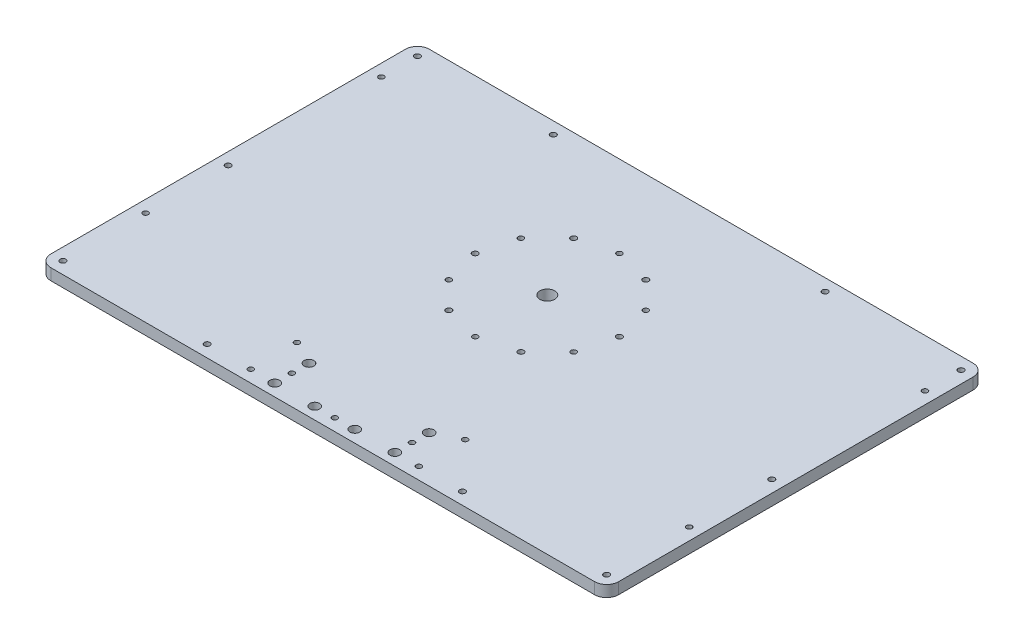
from build123d import *

# Parameters (mm, degrees)
SKETCH1_W           = 300
SKETCH1_H           = 200
BOSS_EXTRUDE1_DEPTH = 6
SKETCH6_R           = 4
CUT_EXTRUDE2_DEPTH  = 361.605047108
FILLET1_R           = 6.35
SKETCH2_R           = 1.5
CUT_EXTRUDE1_DEPTH  = 361.605047108
SKETCH13_R          = 1.6
M3_THROUGH2_DEPTH   = 364.853871767
SKETCH16_R          = 2.65
M5_THROUGH_DEPTH    = 358.420816406
SKETCH9_R           = 1.5
CUT_EXTRUDE3_DEPTH  = 361.605047108
SKETCH10_R          = 1.5
CUT_EXTRUDE5_DEPTH  = 361.605047108
SKETCH17_R          = 1.6
M3_THROUGH_DEPTH    = 361.605047108
MOVE_FACE2_BY       = 0.08
MOVE_FACE2_2_BY     = 0.08
MOVE_FACE2_3_BY     = 0.08
MOVE_FACE2_4_BY     = 0.08
MOVE_FACE2_5_BY     = 0.08
MOVE_FACE2_6_BY     = 0.08
MOVE_FACE2_7_BY     = 0.08
MOVE_FACE2_8_BY     = 0.08
MOVE_FACE2_9_BY     = 0.08
MOVE_FACE2_10_BY    = 0.08
MOVE_FACE2_11_BY    = 0.08
MOVE_FACE2_12_BY    = 0.08
MOVE_FACE2_13_BY    = 0.08
MOVE_FACE2_14_BY    = 0.08
MOVE_FACE2_15_BY    = 0.08
MOVE_FACE2_16_BY    = 0.08
MOVE_FACE2_17_BY    = 0.08
MOVE_FACE2_18_BY    = 0.08
MOVE_FACE2_19_BY    = 0.08
MOVE_FACE2_20_BY    = 0.08
MOVE_FACE2_21_BY    = 0.08
MOVE_FACE2_22_BY    = 0.08
MOVE_FACE2_23_BY    = 0.08
MOVE_FACE2_24_BY    = 0.08
MOVE_FACE2_25_BY    = 0.08
MOVE_FACE2_26_BY    = 0.08
MOVE_FACE2_27_BY    = 0.08
MOVE_FACE2_28_BY    = 0.08
MOVE_FACE2_29_BY    = 0.08
MOVE_FACE2_30_BY    = 0.08
MOVE_FACE2_31_BY    = 0.08
MOVE_FACE2_32_BY    = 0.08
MOVE_FACE2_33_BY    = 0.08
MOVE_FACE2_34_BY    = 0.08
MOVE_FACE2_35_BY    = 0.08
MOVE_FACE2_36_BY    = 0.08
MOVE_FACE2_37_BY    = 0.08
MOVE_FACE2_38_BY    = 0.08
MOVE_FACE2_39_BY    = 0.08
MOVE_FACE2_40_BY    = 0.08


with BuildPart() as part:
    # Sketch1 → Boss-Extrude1 (new body)
    with BuildSketch(Plane(origin=(0, 0, 0), x_dir=(1, 0, 0), z_dir=(0, 1, 0))):
        with Locations((150, 100)):
            Rectangle(SKETCH1_W, SKETCH1_H)
    extrude(amount=BOSS_EXTRUDE1_DEPTH)

    # Sketch6 → Cut-Extrude2 (cut, through all)
    with BuildSketch(Plane(origin=(0, 6, 0), x_dir=(1, 0, 0), z_dir=(0, 1, 0))):
        with Locations(Location((150, 118.65102, 0), (0, 0, 270))):
            Circle(SKETCH6_R)
    extrude(amount=-CUT_EXTRUDE2_DEPTH, mode=Mode.SUBTRACT)

    # Fillet1
    fillet1_edges = [part.edges().sort_by_distance(p)[0] for p in [
        (0, 3, -200),
        (300, 3, -200),
        (300, 3, 0),
        (0, 3, 0),
    ]]
    fillet(fillet1_edges, radius=FILLET1_R)

    # Sketch2 → Cut-Extrude1 (cut, through all)
    with BuildSketch(Plane(origin=(0, 6, 0), x_dir=(1, 0, 0), z_dir=(0, 1, 0))):
        with Locations(Location((6.35, 174.6, 0), (0, 0, 270))):
            Circle(SKETCH2_R)
        with Locations(Location((6.35, 49.9999, 0), (0, 0, 270))):
            Circle(SKETCH2_R)
        with Locations(Location((293.65, 49.9999, 0), (0, 0, 270))):
            Circle(SKETCH2_R)
        with Locations(Location((293.65, 174.6, 0), (0, 0, 270))):
            Circle(SKETCH2_R)
    extrude(amount=-CUT_EXTRUDE1_DEPTH, mode=Mode.SUBTRACT)

    # Sketch13 → M3-through2 (cut, through all)
    with BuildSketch(Plane(origin=(0, 6, 5.8), x_dir=(1, 0, 0), z_dir=(0, 1, 0))):
        with Locations(Location((6.35, 199.45, 0), (0, 0, 270))):
            Circle(SKETCH13_R)
        with Locations(Location((78.175, 199.45, 0), (0, 0, 270))):
            Circle(SKETCH13_R)
        with Locations(Location((221.825, 199.45, 0), (0, 0, 270))):
            Circle(SKETCH13_R)
        with Locations(Location((293.65, 199.45, 0), (0, 0, 270))):
            Circle(SKETCH13_R)
        with Locations(Location((293.65, 99.4498, 0), (0, 0, 270))):
            Circle(SKETCH13_R)
        with Locations(Location((293.65, 12.15, 0), (0, 0, 270))):
            Circle(SKETCH13_R)
        with Locations(Location((217.45, 12.15, 0), (0, 0, 270))):
            Circle(SKETCH13_R)
        with Locations(Location((82.55, 12.15, 0), (0, 0, 270))):
            Circle(SKETCH13_R)
        with Locations(Location((6.35, 12.15, 0), (0, 0, 270))):
            Circle(SKETCH13_R)
        with Locations(Location((6.35, 99.4498, 0), (0, 0, 270))):
            Circle(SKETCH13_R)
    extrude(amount=-M3_THROUGH2_DEPTH, mode=Mode.SUBTRACT)

    # Sketch16 → M5_through (cut, through all)
    with BuildSketch(Plane(origin=(0, 6, -5.8), x_dir=(1, 0, 0), z_dir=(0, -1, 0))):
        with Locations(Location((118.25, -18.65102, 0), (0, 0, 270))):
            Circle(SKETCH16_R)
        with Locations(Location((118.25, -0.55098, 0), (0, 0, 270))):
            Circle(SKETCH16_R)
        with Locations(Location((139.416666667, -0.55098, 0), (0, 0, 270))):
            Circle(SKETCH16_R)
        with Locations(Location((160.583333333, -0.55098, 0), (0, 0, 270))):
            Circle(SKETCH16_R)
        with Locations(Location((181.75, -0.55098, 0), (0, 0, 270))):
            Circle(SKETCH16_R)
        with Locations(Location((181.75, -18.65102, 0), (0, 0, 270))):
            Circle(SKETCH16_R)
    extrude(amount=M5_THROUGH_DEPTH, mode=Mode.SUBTRACT)

    # Sketch9 → Cut-Extrude3 (cut, through all)
    with BuildSketch(Plane(origin=(0, 6, 0), x_dir=(-1, 0, 0), z_dir=(0, 1, 0))):
        with Locations(Location((-118.25, -15.401, 0), (0, 0, 90))):
            Circle(SKETCH9_R)
        with Locations(Location((-150, -6.35098, 0), (0, 0, 90))):
            Circle(SKETCH9_R)
        with Locations(Location((-181.75, -15.401, 0), (0, 0, 90))):
            Circle(SKETCH9_R)
    extrude(amount=-CUT_EXTRUDE3_DEPTH, mode=Mode.SUBTRACT)

    # Sketch10 → Cut-Extrude5 (cut, through all)
    with BuildSketch(Plane(origin=(0, 6, 0), x_dir=(1, 0, 0), z_dir=(0, 1, 0))):
        with Locations(Location((150, 156.75102, 0), (0, 0, 270))):
            Circle(SKETCH10_R)
        with Locations(Location((182.995567884, 137.70102, 0), (0, 0, 270))):
            Circle(SKETCH10_R)
        with Locations(Location((182.995567884, 99.60102, 0), (0, 0, 270))):
            Circle(SKETCH10_R)
        with Locations(Location((150, 80.55102, 0), (0, 0, 270))):
            Circle(SKETCH10_R)
        with Locations(Location((117.004432116, 99.60102, 0), (0, 0, 270))):
            Circle(SKETCH10_R)
        with Locations(Location((117.004432116, 137.70102, 0), (0, 0, 270))):
            Circle(SKETCH10_R)
        with Locations(Location((105.55, 30.80102, 0), (0, 0, 270))):
            Circle(SKETCH10_R)
        with Locations(Location((105.55, 6.35, 0), (0, 0, 270))):
            Circle(SKETCH10_R)
        with Locations(Location((194.45, 6.35, 0), (0, 0, 90))):
            Circle(SKETCH10_R)
        with Locations(Location((194.45, 30.80102, 0), (0, 0, 90))):
            Circle(SKETCH10_R)
    extrude(amount=-CUT_EXTRUDE5_DEPTH, mode=Mode.SUBTRACT)

    # Sketch17 → M3-through (cut, through all)
    with BuildSketch(Plane(origin=(0, 6, 0), x_dir=(1, 0, 0), z_dir=(0, 1, 0))):
        with Locations(Location((188.1, 118.65102, 0), (0, 0, 270))):
            Circle(SKETCH17_R)
        with Locations(Location((169.05, 85.655452116, 0), (0, 0, 270))):
            Circle(SKETCH17_R)
        with Locations(Location((130.95, 85.655452116, 0), (0, 0, 270))):
            Circle(SKETCH17_R)
        with Locations(Location((111.9, 118.65102, 0), (0, 0, 270))):
            Circle(SKETCH17_R)
        with Locations(Location((130.95, 151.646587884, 0), (0, 0, 270))):
            Circle(SKETCH17_R)
        with Locations(Location((169.05, 151.646587884, 0), (0, 0, 270))):
            Circle(SKETCH17_R)
    extrude(amount=-M3_THROUGH_DEPTH, mode=Mode.SUBTRACT)

    # Move Face2: a curved face moved outward by 0.08
    add(Solid.thicken(part.faces().sort_by_distance((150, 3, -122.65102))[0], MOVE_FACE2_BY))

    # Move Face2 2: a curved face moved outward by 0.08
    add(Solid.thicken(part.faces().sort_by_distance((6.35, 3, -176.1))[0], MOVE_FACE2_2_BY))

    # Move Face2 3: a curved face moved outward by 0.08
    add(Solid.thicken(part.faces().sort_by_distance((6.35, 3, -51.4999))[0], MOVE_FACE2_3_BY))

    # Move Face2 4: a curved face moved outward by 0.08
    add(Solid.thicken(part.faces().sort_by_distance((293.65, 3, -51.4999))[0], MOVE_FACE2_4_BY))

    # Move Face2 5: a curved face moved outward by 0.08
    add(Solid.thicken(part.faces().sort_by_distance((293.65, 3, -176.1))[0], MOVE_FACE2_5_BY))

    # Move Face2 6: a curved face moved outward by 0.08
    add(Solid.thicken(part.faces().sort_by_distance((6.35, 3, -195.25))[0], MOVE_FACE2_6_BY))

    # Move Face2 7: a curved face moved outward by 0.08
    add(Solid.thicken(part.faces().sort_by_distance((78.175, 3, -195.25))[0], MOVE_FACE2_7_BY))

    # Move Face2 8: a curved face moved outward by 0.08
    add(Solid.thicken(part.faces().sort_by_distance((221.825, 3, -195.25))[0], MOVE_FACE2_8_BY))

    # Move Face2 9: a curved face moved outward by 0.08
    add(Solid.thicken(part.faces().sort_by_distance((293.65, 3, -195.25))[0], MOVE_FACE2_9_BY))

    # Move Face2 10: a curved face moved outward by 0.08
    add(Solid.thicken(part.faces().sort_by_distance((293.65, 3, -95.2498))[0], MOVE_FACE2_10_BY))

    # Move Face2 11: a curved face moved outward by 0.08
    add(Solid.thicken(part.faces().sort_by_distance((293.65, 3, -7.95))[0], MOVE_FACE2_11_BY))

    # Move Face2 12: a curved face moved outward by 0.08
    add(Solid.thicken(part.faces().sort_by_distance((217.45, 3, -7.95))[0], MOVE_FACE2_12_BY))

    # Move Face2 13: a curved face moved outward by 0.08
    add(Solid.thicken(part.faces().sort_by_distance((82.55, 3, -7.95))[0], MOVE_FACE2_13_BY))

    # Move Face2 14: a curved face moved outward by 0.08
    add(Solid.thicken(part.faces().sort_by_distance((6.35, 3, -7.95))[0], MOVE_FACE2_14_BY))

    # Move Face2 15: a curved face moved outward by 0.08
    add(Solid.thicken(part.faces().sort_by_distance((6.35, 3, -95.2498))[0], MOVE_FACE2_15_BY))

    # Move Face2 16: a curved face moved outward by 0.08
    add(Solid.thicken(part.faces().sort_by_distance((118.25, 3, -21.80102))[0], MOVE_FACE2_16_BY))

    # Move Face2 17: a curved face moved outward by 0.08
    add(Solid.thicken(part.faces().sort_by_distance((118.25, 3, -3.70098))[0], MOVE_FACE2_17_BY))

    # Move Face2 18: a curved face moved outward by 0.08
    add(Solid.thicken(part.faces().sort_by_distance((139.416666667, 3, -3.70098))[0], MOVE_FACE2_18_BY))

    # Move Face2 19: a curved face moved outward by 0.08
    add(Solid.thicken(part.faces().sort_by_distance((160.583333333, 3, -3.70098))[0], MOVE_FACE2_19_BY))

    # Move Face2 20: a curved face moved outward by 0.08
    add(Solid.thicken(part.faces().sort_by_distance((181.75, 3, -3.70098))[0], MOVE_FACE2_20_BY))

    # Move Face2 21: a curved face moved outward by 0.08
    add(Solid.thicken(part.faces().sort_by_distance((181.75, 3, -21.80102))[0], MOVE_FACE2_21_BY))

    # Move Face2 22: a curved face moved outward by 0.08
    add(Solid.thicken(part.faces().sort_by_distance((118.25, 3, -16.901))[0], MOVE_FACE2_22_BY))

    # Move Face2 23: a curved face moved outward by 0.08
    add(Solid.thicken(part.faces().sort_by_distance((150, 3, -7.85098))[0], MOVE_FACE2_23_BY))

    # Move Face2 24: a curved face moved outward by 0.08
    add(Solid.thicken(part.faces().sort_by_distance((181.75, 3, -16.901))[0], MOVE_FACE2_24_BY))

    # Move Face2 25: a curved face moved outward by 0.08
    add(Solid.thicken(part.faces().sort_by_distance((150, 3, -158.25102))[0], MOVE_FACE2_25_BY))

    # Move Face2 26: a curved face moved outward by 0.08
    add(Solid.thicken(part.faces().sort_by_distance((182.995567884, 3, -139.20102))[0], MOVE_FACE2_26_BY))

    # Move Face2 27: a curved face moved outward by 0.08
    add(Solid.thicken(part.faces().sort_by_distance((182.995567884, 3, -101.10102))[0], MOVE_FACE2_27_BY))

    # Move Face2 28: a curved face moved outward by 0.08
    add(Solid.thicken(part.faces().sort_by_distance((150, 3, -82.05102))[0], MOVE_FACE2_28_BY))

    # Move Face2 29: a curved face moved outward by 0.08
    add(Solid.thicken(part.faces().sort_by_distance((117.004432116, 3, -101.10102))[0], MOVE_FACE2_29_BY))

    # Move Face2 30: a curved face moved outward by 0.08
    add(Solid.thicken(part.faces().sort_by_distance((117.004432116, 3, -139.20102))[0], MOVE_FACE2_30_BY))

    # Move Face2 31: a curved face moved outward by 0.08
    add(Solid.thicken(part.faces().sort_by_distance((105.55, 3, -32.30102))[0], MOVE_FACE2_31_BY))

    # Move Face2 32: a curved face moved outward by 0.08
    add(Solid.thicken(part.faces().sort_by_distance((105.55, 3, -7.85))[0], MOVE_FACE2_32_BY))

    # Move Face2 33: a curved face moved outward by 0.08
    add(Solid.thicken(part.faces().sort_by_distance((194.45, 3, -4.85))[0], MOVE_FACE2_33_BY))

    # Move Face2 34: a curved face moved outward by 0.08
    add(Solid.thicken(part.faces().sort_by_distance((194.45, 3, -29.30102))[0], MOVE_FACE2_34_BY))

    # Move Face2 35: a curved face moved outward by 0.08
    add(Solid.thicken(part.faces().sort_by_distance((188.1, 3, -120.25102))[0], MOVE_FACE2_35_BY))

    # Move Face2 36: a curved face moved outward by 0.08
    add(Solid.thicken(part.faces().sort_by_distance((169.05, 3, -87.255452116))[0], MOVE_FACE2_36_BY))

    # Move Face2 37: a curved face moved outward by 0.08
    add(Solid.thicken(part.faces().sort_by_distance((130.95, 3, -87.255452116))[0], MOVE_FACE2_37_BY))

    # Move Face2 38: a curved face moved outward by 0.08
    add(Solid.thicken(part.faces().sort_by_distance((111.9, 3, -120.25102))[0], MOVE_FACE2_38_BY))

    # Move Face2 39: a curved face moved outward by 0.08
    add(Solid.thicken(part.faces().sort_by_distance((130.95, 3, -153.246587884))[0], MOVE_FACE2_39_BY))

    # Move Face2 40: a curved face moved outward by 0.08
    add(Solid.thicken(part.faces().sort_by_distance((169.05, 3, -153.246587884))[0], MOVE_FACE2_40_BY))


solid = part.part
